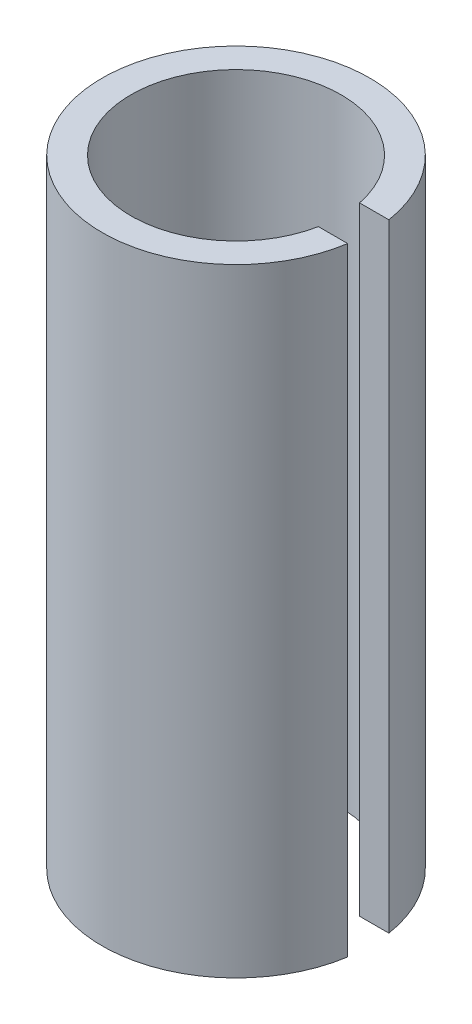
from build123d import *

# Parameters (mm, degrees)
BOSS_EXTRUDE1_DEPTH = 15


with BuildPart() as part:
    # Sketch1 → Boss-Extrude1 (new body)
    with BuildSketch(Plane(origin=(0, 0, 0), x_dir=(1, 0, 0), z_dir=(0, 1, 0))):
        with BuildLine():
            ThreePointArc((2.50049995, -0.5), (-2.55, 0), (2.50049995, 0.5))
            Line((2.50049995, 0.5), (3.211308145, 0.5))
            ThreePointArc((3.211308145, 0.5), (-3.25, 0), (3.211308145, -0.5))
            Line((3.211308145, -0.5), (2.50049995, -0.5))
        make_face()
    extrude(amount=BOSS_EXTRUDE1_DEPTH)


solid = part.part
